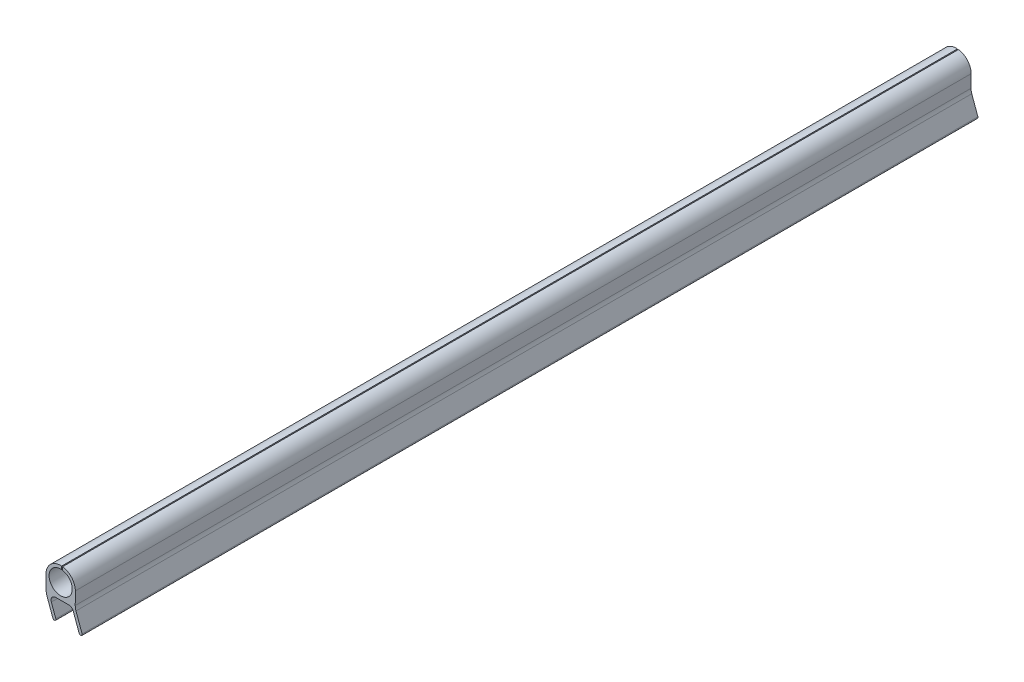
from build123d import *

# Parameters (mm, degrees)
BOSS_EXTRUDE1_DEPTH = 580


with BuildPart() as part:
    # Sketch3 → Boss-Extrude1 (new body)
    with BuildSketch(Plane.XY):
        with BuildLine():
            Line((-6.034633842, -14.02606043), (-3.148633912, -21.955280071))
            ThreePointArc((-3.148633912, -21.955280071), (-3.746306389, -23.236992835), (-5.028019153, -22.639320358))
            Line((-5.028019153, -22.639320358), (-8.776311449, -12.340971913))
            ThreePointArc((-8.776311449, -12.340971913), (-9.317693036, -10.320508325), (-9.5, -8.236730193))
            Line((-9.5, -8.236730193), (-9.5, 0))
            ThreePointArc((-9.5, 0), (-6.488568374, 6.93891061), (0.636522201, 9.478651776))
            Line((0.636522201, 9.478651776), (0.502517527, 7.483146139))
            ThreePointArc((0.502517527, 7.483146139), (-5.12255398, 5.478087324), (-7.5, 0))
            ThreePointArc((-7.5, 0), (0, -7.5), (7.5, 0))
            ThreePointArc((7.5, 0), (5.645794895, 4.937104415), (1, 7.433034374))
            Line((1, 7.433034374), (1.266666667, 9.415176873))
            ThreePointArc((1.266666667, 9.415176873), (7.151340201, 6.253665592), (9.5, 0))
            Line((9.5, 0), (9.425154073, -8.236390129))
            ThreePointArc((9.425154073, -8.236390129), (9.540131353, -9.662460438), (9.907282817, -11.045246071))
            Line((9.907282817, -11.045246071), (13.878210448, -21.955280071))
            ThreePointArc((13.878210448, -21.955280071), (13.28053797, -23.236992835), (11.998825206, -22.639320358))
            Line((11.998825206, -22.639320358), (8.116944062, -11.97393957))
            ThreePointArc((8.116944062, -11.97393957), (7.018595509, -10.542543867), (5.2978662, -10))
            Line((5.2978662, -10), (-3.21555598, -10))
            ThreePointArc((-3.21555598, -10), (-5.673012113, -11.279270691), (-6.034633842, -14.02606043))
        make_face()
    extrude(amount=-BOSS_EXTRUDE1_DEPTH)


solid = part.part
